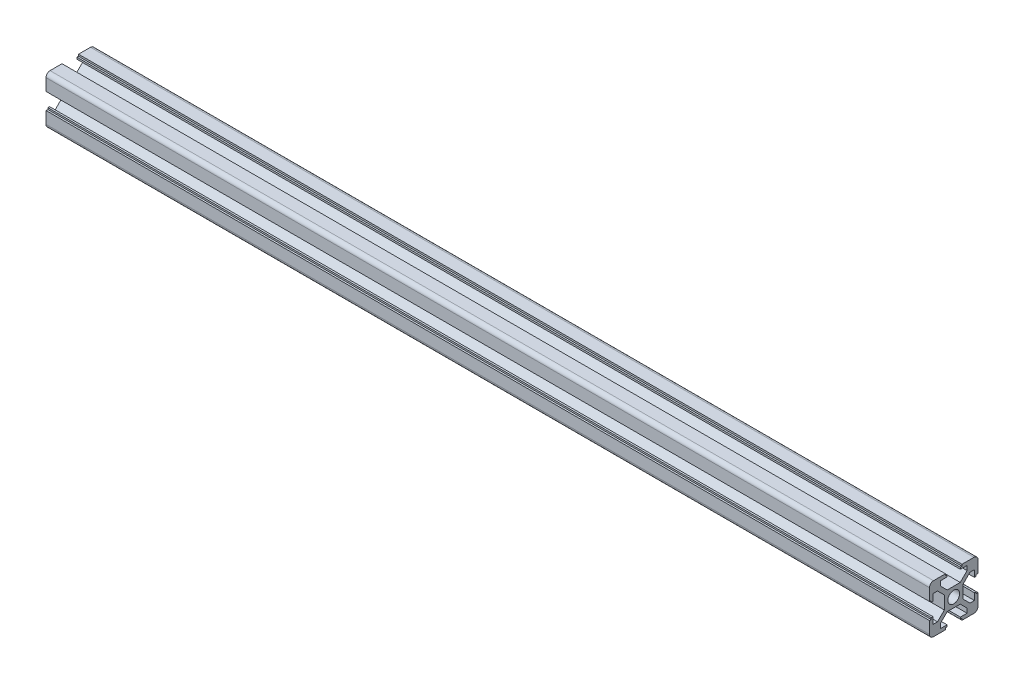
from build123d import *

# Parameters (mm, degrees)
SKETCH11_R                          = 3.65
BOSCHREXROTH_BOSCH_30X30_V2_1_DEPTH = 546.1


with BuildPart() as part:
    # Sketch11 → Boschrexroth BOSCH_30X30_V2(1) (new body)
    with BuildSketch(Plane.YZ.offset(-273.05)):
        with BuildLine():
            Line((0, 5.8), (-4.03, 5.8))
            Line((-4.03, 5.8), (-8.25, 10.02))
            Line((-8.25, 10.02), (-8.25, 12.8))
            Line((-8.25, 12.8), (-4.1, 12.8))
            Line((-4.1, 12.8), (-4.1, 13.9))
            Line((-4.1, 13.9), (-5.1, 13.9))
            Line((-5.1, 13.9), (-5.1, 15))
            Line((-5.1, 15), (-12.5, 15))
            ThreePointArc((-12.5, 15), (-14.267766953, 14.267766953), (-15, 12.5))
            Line((-15, 12.5), (-15, 5.1))
            Line((-15, 5.1), (-13.9, 5.1))
            Line((-13.9, 5.1), (-13.9, 4.1))
            Line((-13.9, 4.1), (-12.8, 4.1))
            Line((-12.8, 4.1), (-12.8, 8.25))
            Line((-12.8, 8.25), (-10.02, 8.25))
            Line((-10.02, 8.25), (-5.8, 4.03))
            Line((-5.8, 4.03), (-5.8, 0))
            Line((-5.8, 0), (-5.8, -4.03))
            Line((-5.8, -4.03), (-10.02, -8.25))
            Line((-10.02, -8.25), (-12.8, -8.25))
            Line((-12.8, -8.25), (-12.8, -4.1))
            Line((-12.8, -4.1), (-13.9, -4.1))
            Line((-13.9, -4.1), (-13.9, -5.1))
            Line((-13.9, -5.1), (-15, -5.1))
            Line((-15, -5.1), (-15, -12.5))
            ThreePointArc((-15, -12.5), (-14.267766953, -14.267766953), (-12.5, -15))
            Line((-12.5, -15), (-5.1, -15))
            Line((-5.1, -15), (-5.1, -13.9))
            Line((-5.1, -13.9), (-4.1, -13.9))
            Line((-4.1, -13.9), (-4.1, -12.8))
            Line((-4.1, -12.8), (-8.25, -12.8))
            Line((-8.25, -12.8), (-8.25, -10.02))
            Line((-8.25, -10.02), (-4.03, -5.8))
            Line((-4.03, -5.8), (4.03, -5.8))
            Line((4.03, -5.8), (8.25, -10.02))
            Line((8.25, -10.02), (8.25, -12.8))
            Line((8.25, -12.8), (4.1, -12.8))
            Line((4.1, -12.8), (4.1, -13.9))
            Line((4.1, -13.9), (5.1, -13.9))
            Line((5.1, -13.9), (5.1, -15))
            Line((5.1, -15), (12.5, -15))
            ThreePointArc((12.5, -15), (14.267766953, -14.267766953), (15, -12.5))
            Line((15, -12.5), (15, -5.1))
            Line((15, -5.1), (13.9, -5.1))
            Line((13.9, -5.1), (13.9, -4.1))
            Line((13.9, -4.1), (12.8, -4.1))
            Line((12.8, -4.1), (12.8, -8.25))
            Line((12.8, -8.25), (10.02, -8.25))
            Line((10.02, -8.25), (5.8, -4.03))
            Line((5.8, -4.03), (5.8, 0))
            Line((5.8, 0), (5.8, 4.03))
            Line((5.8, 4.03), (10.02, 8.25))
            Line((10.02, 8.25), (12.8, 8.25))
            Line((12.8, 8.25), (12.8, 4.1))
            Line((12.8, 4.1), (13.9, 4.1))
            Line((13.9, 4.1), (13.9, 5.1))
            Line((13.9, 5.1), (15, 5.1))
            Line((15, 5.1), (15, 12.5))
            ThreePointArc((15, 12.5), (14.267766953, 14.267766953), (12.5, 15))
            Line((12.5, 15), (5.1, 15))
            Line((5.1, 15), (5.1, 13.9))
            Line((5.1, 13.9), (4.1, 13.9))
            Line((4.1, 13.9), (4.1, 12.8))
            Line((4.1, 12.8), (8.25, 12.8))
            Line((8.25, 12.8), (8.25, 10.02))
            Line((8.25, 10.02), (4.03, 5.8))
            Line((4.03, 5.8), (0, 5.8))
        make_face()
        Circle(SKETCH11_R, mode=Mode.SUBTRACT)
    extrude(amount=BOSCHREXROTH_BOSCH_30X30_V2_1_DEPTH)


solid = part.part
